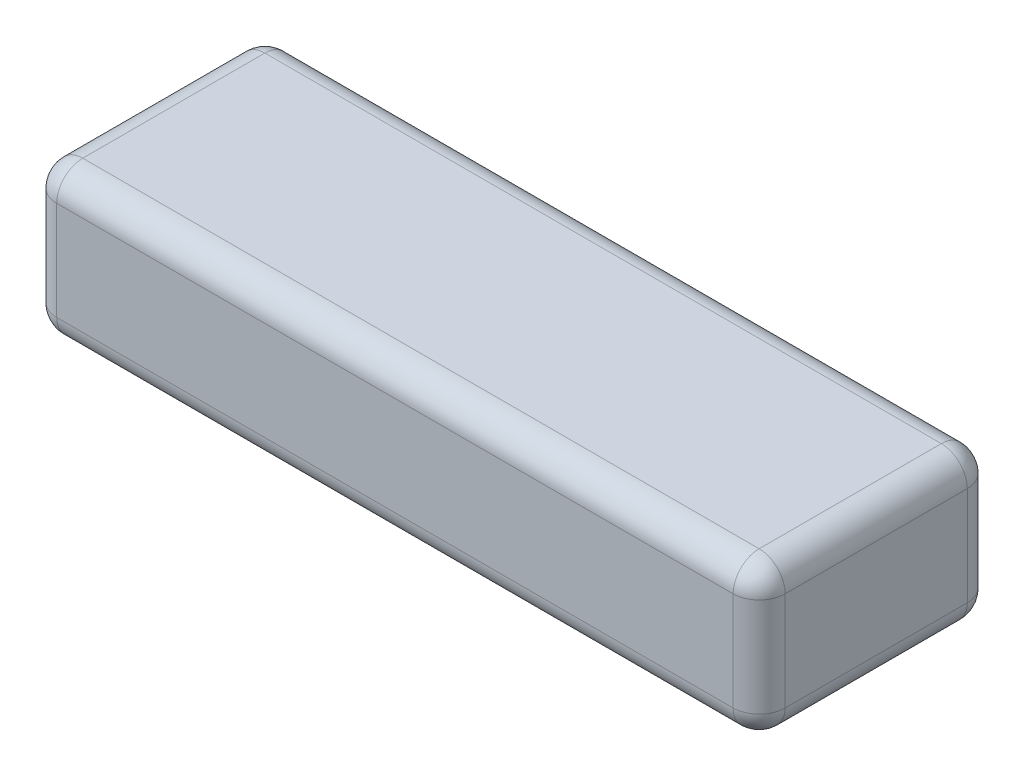
from build123d import *

# Parameters (mm, degrees)
SKETCH2_W           = 140
SKETCH2_H           = 45
BOSS_EXTRUDE1_DEPTH = 29
FILLET1_R           = 5


with BuildPart() as part:
    # Sketch2 → Boss-Extrude1 (new body)
    with BuildSketch(Plane(origin=(0, 0, 0), x_dir=(1, 0, 0), z_dir=(0, 1, 0))):
        Rectangle(SKETCH2_W, SKETCH2_H)
    extrude(amount=BOSS_EXTRUDE1_DEPTH)

    # Fillet1
    fillet1_edges = [part.edges().sort_by_distance(p)[0] for p in [
        (70, 29, 0),
        (0, 29, -22.5),
        (-70, 29, 0),
        (0, 0, -22.5),
        (70, 0, 0),
        (0, 0, 22.5),
        (-70, 0, 0),
        (-70, 14.5, -22.5),
        (70, 14.5, -22.5),
        (70, 14.5, 22.5),
        (-70, 14.5, 22.5),
        (0, 29, 22.5),
    ]]
    fillet(fillet1_edges, radius=FILLET1_R)


solid = part.part
